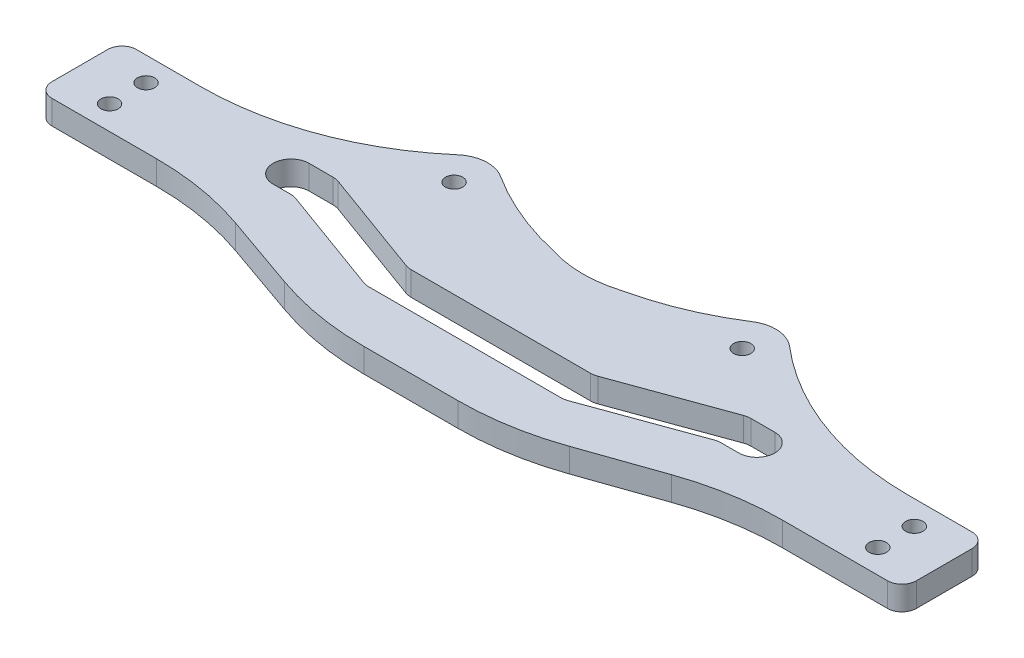
from build123d import *

# Parameters (mm, degrees)
SKETCH1_R           = 2.286
BOSS_EXTRUDE1_DEPTH = 6.35
FILLET2_R           = 3.81
FILLET3_R           = 76.2


with BuildPart() as part:
    # Sketch1 → Boss-Extrude1 (new body)
    with BuildSketch(Plane(origin=(0, 0, 0), x_dir=(1, 0, 0), z_dir=(0, 1, 0))):
        with BuildLine():
            ThreePointArc((29.21, 30.48), (38.1, 39.37), (46.99, 30.48))
            Line((46.99, 30.48), (46.99, 18.8595))
            Line((46.99, 18.8595), (114.318469952, 18.8595))
            Line((114.318469952, 18.8595), (114.318469952, -3.4925))
            Line((114.318469952, -3.4925), (69.831530048, -3.4925))
            Line((69.831530048, -3.4925), (25.4, -19.05))
            Line((25.4, -19.05), (-25.4, -19.05))
            Line((-25.4, -19.05), (-69.831530048, -3.4925))
            Line((-69.831530048, -3.4925), (-114.281530048, -3.4925))
            Line((-114.281530048, -3.4925), (-114.281530048, 18.8595))
            Line((-114.281530048, 18.8595), (-46.99, 18.8595))
            Line((-46.99, 18.8595), (-46.99, 30.48))
            ThreePointArc((-46.99, 30.48), (-38.1, 39.37), (-29.21, 30.48))
            Line((-29.21, 30.48), (-29.21, 27.94))
            Line((-29.21, 27.94), (-9.321964372, 27.94))
            ThreePointArc((-9.321964372, 27.94), (0, 26.4795), (9.321964372, 27.94))
            Line((9.321964372, 27.94), (29.21, 27.94))
            Line((29.21, 27.94), (29.21, 30.48))
        make_face()
        with Locations(Location((101.581530048, 2.8575, 0), (0, 0, 270))):
            Circle(SKETCH1_R, mode=Mode.SUBTRACT)
        with Locations(Location((-101.581530048, 12.5095, 0), (0, 0, 270))):
            Circle(SKETCH1_R, mode=Mode.SUBTRACT)
        with Locations(Location((-101.581530048, 2.8575, 0), (0, 0, 270))):
            Circle(SKETCH1_R, mode=Mode.SUBTRACT)
        with Locations(Location((101.581530048, 12.5095, 0), (0, 0, 270))):
            Circle(SKETCH1_R, mode=Mode.SUBTRACT)
        with Locations(Location((-38.1, 30.48, 0), (0, 0, 270))):
            Circle(SKETCH1_R, mode=Mode.SUBTRACT)
        with Locations(Location((38.1, 30.48, 0), (0, 0, 270))):
            Circle(SKETCH1_R, mode=Mode.SUBTRACT)
        with BuildLine():
            Line((27.028870933, -4.475286106), (55.285884269, 5.809425657))
            ThreePointArc((55.285884269, 5.809425657), (56.087755755, 6.024286474), (56.914755201, 6.096639551))
            Line((56.914755201, 6.096639551), (61.58524071, 6.096639551))
            ThreePointArc((61.58524071, 6.096639551), (66.34774071, 10.859139551), (61.58524071, 15.621639551))
            Line((61.58524071, 15.621639551), (55.23524071, 15.621639551))
            ThreePointArc((55.23524071, 15.621639551), (54.408241264, 15.549286474), (53.606369777, 15.334425657))
            Line((53.606369777, 15.334425657), (25.349356441, 5.049713894))
            ThreePointArc((25.349356441, 5.049713894), (24.547484955, 4.834853076), (23.720485509, 4.7625))
            Line((23.720485509, 4.7625), (-23.720485509, 4.7625))
            ThreePointArc((-23.720485509, 4.7625), (-24.547484955, 4.834853076), (-25.349356441, 5.049713894))
            Line((-25.349356441, 5.049713894), (-53.606369777, 15.334425657))
            ThreePointArc((-53.606369777, 15.334425657), (-54.408241264, 15.549286474), (-55.23524071, 15.621639551))
            Line((-55.23524071, 15.621639551), (-61.58524071, 15.621639551))
            ThreePointArc((-61.58524071, 15.621639551), (-66.34774071, 10.859139551), (-61.58524071, 6.096639551))
            Line((-61.58524071, 6.096639551), (-56.914755201, 6.096639551))
            ThreePointArc((-56.914755201, 6.096639551), (-56.087755755, 6.024286474), (-55.285884269, 5.809425657))
            Line((-55.285884269, 5.809425657), (-27.028870933, -4.475286106))
            ThreePointArc((-27.028870933, -4.475286106), (-26.226999446, -4.690146924), (-25.4, -4.7625))
            Line((-25.4, -4.7625), (25.4, -4.7625))
            ThreePointArc((25.4, -4.7625), (26.226999446, -4.690146924), (27.028870933, -4.475286106))
        make_face(mode=Mode.SUBTRACT)
    extrude(amount=BOSS_EXTRUDE1_DEPTH)

    # Fillet2
    fillet2_edges = [part.edges().sort_by_distance(p)[0] for p in [
        (114.318469952, 3.175, -18.8595),
        (114.318469952, 3.175, 3.4925),
        (-114.281530048, 3.175, 3.4925),
        (-114.281530048, 3.175, -18.8595),
        (-9.321964372, 3.175, -27.94),
        (9.321964372, 3.175, -27.94),
    ]]
    fillet(fillet2_edges, radius=FILLET2_R)

    # Fillet3
    fillet3_edges = [part.edges().sort_by_distance(p)[0] for p in [
        (-46.99, 3.175, -18.8595),
        (-29.21, 3.175, -27.94),
        (29.21, 3.175, -27.94),
        (46.99, 3.175, -18.8595),
        (69.831530048, 3.175, 3.4925),
        (25.4, 3.175, 19.05),
        (-25.4, 3.175, 19.05),
        (-69.831530048, 3.175, 3.4925),
    ]]
    fillet(fillet3_edges, radius=FILLET3_R)


solid = part.part
